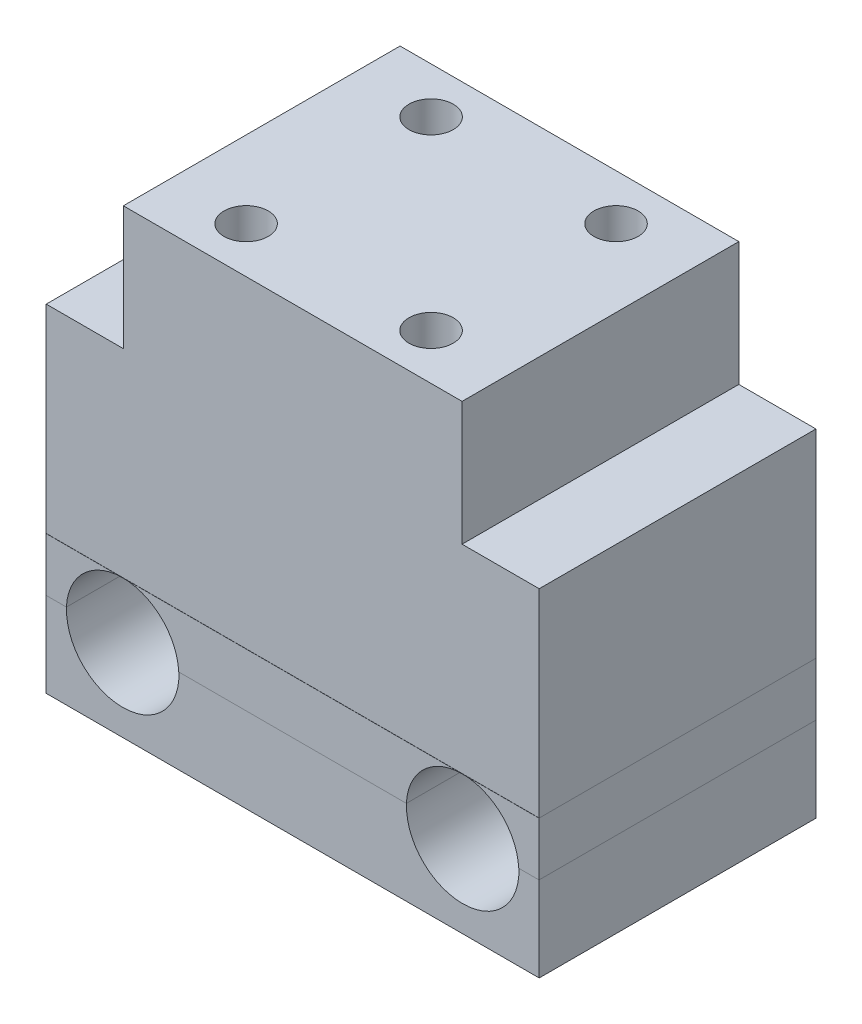
from build123d import *

# Parameters (mm, degrees)
SKETCH1_W               = 25.308
SKETCH1_H               = 20.6756
BOSS_EXTRUDE1_DEPTH     = 9.2424
SKETCH3_W               = 36.83
SKETCH3_H               = 20.6756
BOSS_EXTRUDE2_DEPTH     = 14.8368
SKETCH4_R               = 1.6526
CUT_EXTRUDE2_DEPTH      = 11.1125
SKETCH5_R               = 1.7526
CUT_EXTRUDE3_DEPTH      = 7.9375
BOSS_EXTRUDE7_DEPTH     = 20.6883
BOSS_EXTRUDE7_2_DEPTH   = 20.6883
BOSS_EXTRUDE7_3_DEPTH   = 20.6883
BOSS_EXTRUDE9_DEPTH     = 20.6756
CUT_EXTRUDE5_DEPTH      = 6.35
CUT_EXTRUDE5_DEPTH_BACK = 33.032061249
SKETCH9_R               = 1.6526
CHAMFER1_SIZE           = 0.2


with BuildPart() as part:
    # Sketch1 → Boss-Extrude1 (new body)
    with BuildSketch(Plane(origin=(0, 0, 0), x_dir=(1, 0, 0), z_dir=(0, 1, 0))):
        Rectangle(SKETCH1_W, SKETCH1_H)
    extrude(amount=BOSS_EXTRUDE1_DEPTH)

    # Sketch3 → Boss-Extrude2 (add)
    with BuildSketch(Plane(origin=(0, 0, 0), x_dir=(-1, 0, 0), z_dir=(0, -1, 0))):
        Rectangle(SKETCH3_W, SKETCH3_H)
    extrude(amount=BOSS_EXTRUDE2_DEPTH)

    # Sketch4 → Cut-Extrude2 (cut)
    with BuildSketch(Plane(origin=(0, 9.2424, 0), x_dir=(1, 0, 0), z_dir=(0, 1, 0))):
        with Locations(Location((-6.9088, -6.9088, 0), (0, 0, 270))):
            Circle(SKETCH4_R)
        with Locations(Location((6.9088, -6.9088, 0), (0, 0, 90))):
            Circle(SKETCH4_R)
        with Locations(Location((6.9088, 6.9088, 0), (0, 0, 270))):
            Circle(SKETCH4_R)
        with Locations(Location((-6.9088, 6.9088, 0), (0, 0, 90))):
            Circle(SKETCH4_R)
    extrude(amount=-CUT_EXTRUDE2_DEPTH, mode=Mode.SUBTRACT)

    # Sketch5 → Cut-Extrude3 (cut)
    with BuildSketch(Plane(origin=(0, -14.8368, 0), x_dir=(-1, 0, 0), z_dir=(0, -1, 0))):
        with Locations(Location((-12.7, 0.8128, 0), (0, 0, 90))):
            Circle(SKETCH5_R)
        with Locations(Location((12.7, 0.8128, 0), (0, 0, 270))):
            Circle(SKETCH5_R)
    extrude(amount=-CUT_EXTRUDE3_DEPTH, mode=Mode.SUBTRACT)


with BuildPart() as body_2:
    # Sketch6 → Boss-Extrude7 (new body)
    with BuildSketch(Plane(origin=(0, 0, -10.3378), x_dir=(-1, 0, 0), z_dir=(0, 0, -1))):
        with BuildLine():
            Line((0, -14.8368), (-12.7, -14.8368))
            ThreePointArc((-12.7, -14.8368), (-9.80172469, -15.997063132), (-8.504764612, -18.836799892))
            Line((-8.504764612, -18.836799892), (8.504764612, -18.836799892))
            ThreePointArc((8.504764612, -18.836799892), (9.80172469, -15.997063132), (12.7, -14.8368))
            Line((12.7, -14.8368), (0, -14.8368))
        make_face()
    extrude(amount=-BOSS_EXTRUDE7_DEPTH)


with BuildPart() as body_3:
    # Sketch6 → Boss-Extrude7 2 (new body)
    with BuildSketch(Plane(origin=(0, 0, -10.3378), x_dir=(-1, 0, 0), z_dir=(0, 0, -1))):
        with BuildLine():
            Line((-12.7, -14.8368), (-18.415, -14.8368))
            Line((-18.415, -14.8368), (-18.415, -18.836799892))
            Line((-18.415, -18.836799892), (-16.895235388, -18.836799892))
            ThreePointArc((-16.895235388, -18.836799892), (-15.59827531, -15.997063132), (-12.7, -14.8368))
        make_face()
    extrude(amount=-BOSS_EXTRUDE7_2_DEPTH)


with BuildPart() as body_4:
    # Sketch6 → Boss-Extrude7 3 (new body)
    with BuildSketch(Plane(origin=(0, 0, -10.3378), x_dir=(-1, 0, 0), z_dir=(0, 0, -1))):
        with BuildLine():
            Line((18.415, -14.8368), (12.7, -14.8368))
            ThreePointArc((12.7, -14.8368), (15.59827531, -15.997063132), (16.895235388, -18.836799892))
            Line((16.895235388, -18.836799892), (18.415, -18.836799892))
            Line((18.415, -18.836799892), (18.415, -14.8368))
        make_face()
    extrude(amount=-BOSS_EXTRUDE7_3_DEPTH)


with BuildPart() as body_5:
    # Sketch10 → Boss-Extrude9 (new body)
    with BuildSketch(Plane(origin=(0, 0, -10.3378), x_dir=(-1, 0, 0), z_dir=(0, 0, -1))):
        with BuildLine():
            Line((-18.415, -18.836799892), (-18.415, -25.186799892))
            Line((-18.415, -25.186799892), (18.415, -25.186799892))
            Line((18.415, -25.186799892), (18.415, -18.836799892))
            Line((18.415, -18.836799892), (16.895235388, -18.836799892))
            ThreePointArc((16.895235388, -18.836799892), (12.7, -23.2368), (8.504764612, -18.836799892))
            Line((8.504764612, -18.836799892), (-8.504764612, -18.836799892))
            ThreePointArc((-8.504764612, -18.836799892), (-12.7, -23.2368), (-16.895235388, -18.836799892))
            Line((-16.895235388, -18.836799892), (-18.415, -18.836799892))
        make_face()
    extrude(amount=-BOSS_EXTRUDE9_DEPTH)


with BuildPart() as cut_extrude5_tool:
    # Sketch9 → Cut-Extrude5 (new, two sides: drawn at the far end of the back side and taken through both)
    with BuildSketch(Plane(origin=(0, -14.8368, 0), x_dir=(1, 0, 0), z_dir=(0, 1, 0)).offset(-CUT_EXTRUDE5_DEPTH_BACK)):
        with Locations(Location((-12.7, 0.8128, 0), (0, 0, 90))):
            Circle(SKETCH9_R)
        with Locations(Location((12.7, 0.8128, 0), (0, 0, 90))):
            Circle(SKETCH9_R)
    extrude(amount=CUT_EXTRUDE5_DEPTH + CUT_EXTRUDE5_DEPTH_BACK)


with BuildPart() as body_2_1:
    add(body_2.part)

    # Cut-Extrude5: cut by cut_extrude5_tool
    add(cut_extrude5_tool.part, mode=Mode.SUBTRACT)


with BuildPart() as body_3_1:
    add(body_3.part)

    # Cut-Extrude5: cut by cut_extrude5_tool
    add(cut_extrude5_tool.part, mode=Mode.SUBTRACT)


with BuildPart() as body_4_1:
    add(body_4.part)

    # Cut-Extrude5: cut by cut_extrude5_tool
    add(cut_extrude5_tool.part, mode=Mode.SUBTRACT)


with BuildPart() as body_5_1:
    add(body_5.part)

    # Cut-Extrude5: cut by cut_extrude5_tool
    add(cut_extrude5_tool.part, mode=Mode.SUBTRACT)

    # Chamfer1
    chamfer1_edges = [body_5_1.edges().sort_by_distance(p)[0] for p in [
        (-12.7, -25.186799892, 0.8398),
        (12.7, -25.186799892, 0.8398),
    ]]
    chamfer(chamfer1_edges, length=CHAMFER1_SIZE)


solid = Compound([part.part, body_2_1.part, body_3_1.part, body_4_1.part, body_5_1.part])
